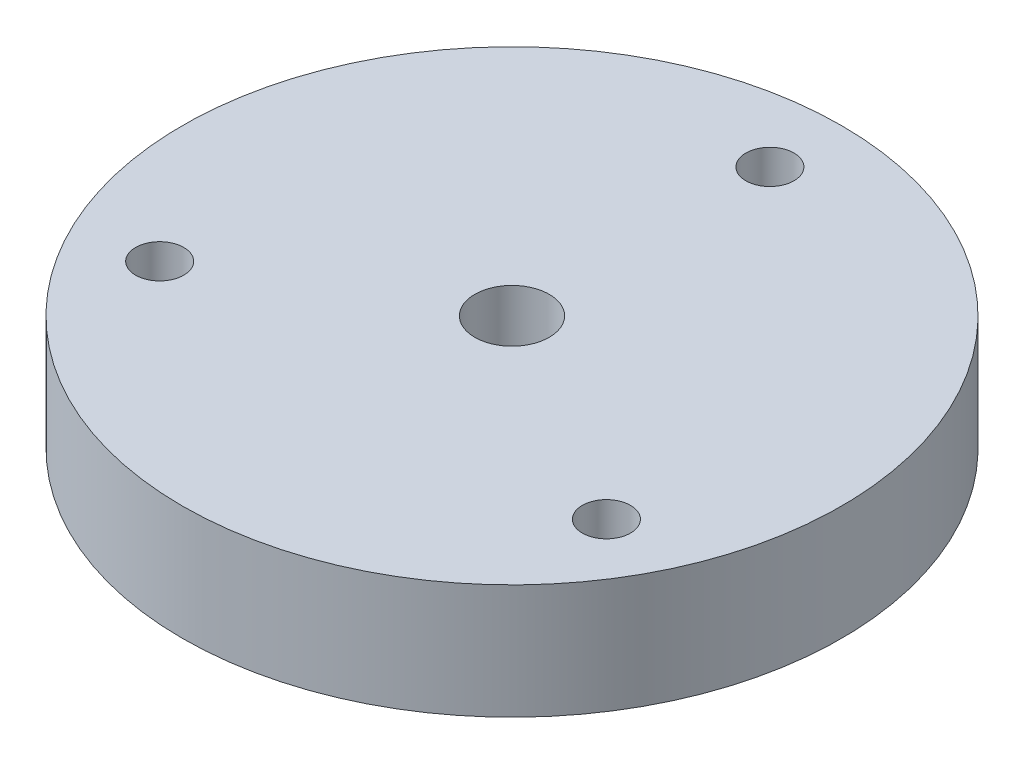
from build123d import *

# Parameters (mm, degrees)
SKETCH2_R           = 28.75
SKETCH2_R_2         = 3.25
SKETCH2_R_3         = 2.1
BOSS_EXTRUDE1_DEPTH = 10


with BuildPart() as part:
    # Sketch2 → Boss-Extrude1 (new body)
    with BuildSketch(Plane(origin=(0, 0, 0), x_dir=(1, 0, 0), z_dir=(0, 1, 0))):
        with Locations(Location((0, 0, 0), (0, 0, 270))):
            Circle(SKETCH2_R)
        with Locations(Location((0, 0, 0), (0, 0, 270))):
            Circle(SKETCH2_R_2, mode=Mode.SUBTRACT)
        with Locations(Location((0, 22.5, 0), (0, 0, 270))):
            Circle(SKETCH2_R_3, mode=Mode.SUBTRACT)
        with Locations(Location((19.485571585, -11.25, 0), (0, 0, 270))):
            Circle(SKETCH2_R_3, mode=Mode.SUBTRACT)
        with Locations(Location((-19.485571585, -11.25, 0), (0, 0, 270))):
            Circle(SKETCH2_R_3, mode=Mode.SUBTRACT)
    extrude(amount=BOSS_EXTRUDE1_DEPTH)


solid = part.part
